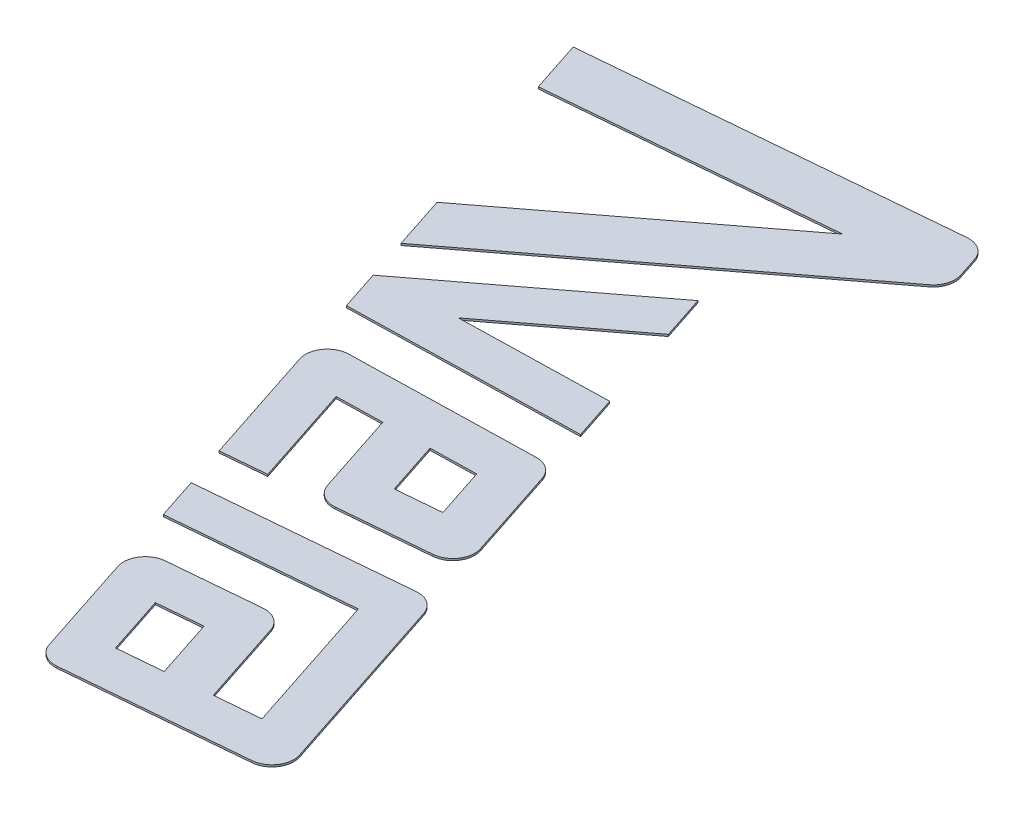
from build123d import *

# Parameters (mm, degrees)
BOSS_EXTRUDE1_DEPTH   = 0.1
BOSS_EXTRUDE1_2_DEPTH = 0.1
BOSS_EXTRUDE1_3_DEPTH = 0.1
BOSS_EXTRUDE1_4_DEPTH = 0.1


with BuildPart() as part:
    # Sketch1 → Boss-Extrude1 (new body)
    with BuildSketch(Plane(origin=(0, 0, 0), x_dir=(1, 0, 0), z_dir=(0, 1, 0))):
        Polygon((6.98019195, 11.199123603), (16.684431195, 18.582207132), (17.442796564, 16.269192757), (11.164089792, 11.492289037), (18.948427041, 11.677019802), (19.696913973, 9.394134661), (7.665603422, 9.108618613), align=None)
    extrude(amount=BOSS_EXTRUDE1_DEPTH)


with BuildPart() as body_2:
    # Sketch1 → Boss-Extrude1 2 (new body)
    with BuildSketch(Plane(origin=(0, 0, 0), x_dir=(1, 0, 0), z_dir=(0, 1, 0))):
        with BuildLine():
            Line((19.559550761, 7.188342037), (9.930020512, 6.959822841))
            ThreePointArc((9.930020512, 6.959822841), (9.018095469, 6.473763981), (8.864539605, 5.451863254))
            Line((8.864539605, 5.451863254), (10.932369195, -0.855016994))
            Line((10.932369195, -0.855016994), (13.284911092, -0.64784301))
            Line((13.284911092, -0.64784301), (11.532437194, 4.697202379))
            Line((11.532437194, 4.697202379), (13.080287744, 4.733934551))
            Line((13.080287744, 4.733934551), (13.934217495, 4.75419923))
            Line((13.934217495, 4.75419923), (14.200334782, 3.942541503))
            Line((14.200334782, 3.942541503), (15.353073683, 0.426687855))
            ThreePointArc((15.353073683, 0.426687855), (15.812662586, -0.175023319), (16.546720694, -0.360595378))
            Line((16.546720694, -0.360595378), (21.273754131, 0.05568556))
            ThreePointArc((21.273754131, 0.05568556), (22.132865535, 0.568076993), (22.265635064, 1.559535333))
            Line((22.265635064, 1.559535333), (20.679597799, 6.39694899))
            ThreePointArc((20.679597799, 6.39694899), (20.250451284, 6.977873828), (19.559550761, 7.188342037))
        make_face()
        Polygon((17.276171965, 2.012544247), (16.358406841, 4.811727872), (18.760187142, 4.868724724), (19.628713861, 2.219718231), align=None, mode=Mode.SUBTRACT)
    extrude(amount=BOSS_EXTRUDE1_2_DEPTH)


with BuildPart() as body_3:
    # Sketch1 → Boss-Extrude1 3 (new body)
    with BuildSketch(Plane(origin=(0, 0, 0), x_dir=(1, 0, 0), z_dir=(0, 1, 0))):
        with BuildLine():
            Line((6.263625411, 13.384651547), (5.340398005, 16.200495135))
            Line((5.340398005, 16.200495135), (17.459500781, 25.420831303))
            Line((17.459500781, 25.420831303), (2.742299504, 24.124695563))
            Line((2.742299504, 24.124695563), (1.846577535, 26.85664757))
            Line((1.846577535, 26.85664757), (20.884224807, 28.533282589))
            ThreePointArc((20.884224807, 28.533282589), (21.618286586, 28.347712831), (22.077878135, 27.745999912))
            Line((22.077878135, 27.745999912), (22.434184025, 26.659266946))
            ThreePointArc((22.434184025, 26.659266946), (22.439445548, 25.959164993), (22.037735709, 25.385754466))
            Line((22.037735709, 25.385754466), (6.263625411, 13.384651547))
        make_face()
    extrude(amount=BOSS_EXTRUDE1_3_DEPTH)


with BuildPart() as body_4:
    # Sketch1 → Boss-Extrude1 4 (new body)
    with BuildSketch(Plane(origin=(0, 0, 0), x_dir=(1, 0, 0), z_dir=(0, 1, 0))):
        with BuildLine():
            Line((11.648935734, -3.040544938), (12.365502273, -5.226072882))
            Line((12.365502273, -5.226072882), (21.797619503, -4.395443977))
            Line((21.797619503, -4.395443977), (24.270818832, -11.93870193))
            Line((24.270818832, -11.93870193), (21.918276935, -12.145875914))
            Line((21.918276935, -12.145875914), (20.446023451, -7.655502787))
            ThreePointArc((20.446023451, -7.655502787), (19.986434548, -7.053791613), (19.25237644, -6.868219553))
            Line((19.25237644, -6.868219553), (14.525343003, -7.284500491))
            ThreePointArc((14.525343003, -7.284500491), (13.666231599, -7.796891925), (13.53346207, -8.788350264))
            Line((13.53346207, -8.788350264), (15.29009486, -14.146080273))
            ThreePointArc((15.29009486, -14.146080273), (15.749683763, -14.747791447), (16.483741871, -14.933363506))
            Line((16.483741871, -14.933363506), (25.915859101, -14.1027346))
            ThreePointArc((25.915859101, -14.1027346), (26.774970506, -13.590343167), (26.907740034, -12.598884828))
            Line((26.907740034, -12.598884828), (23.717974166, -2.870098931))
            ThreePointArc((23.717974166, -2.870098931), (23.258385264, -2.268387757), (22.524327155, -2.082815697))
            Line((22.524327155, -2.082815697), (11.648935734, -3.040544938))
        make_face()
        Polygon((17.191243499, -12.562156852), (19.543785396, -12.354982868), (18.522925169, -9.241359178), (16.170383273, -9.448533162), align=None, mode=Mode.SUBTRACT)
    extrude(amount=BOSS_EXTRUDE1_4_DEPTH)


solid = Compound([part.part, body_2.part, body_3.part, body_4.part])
